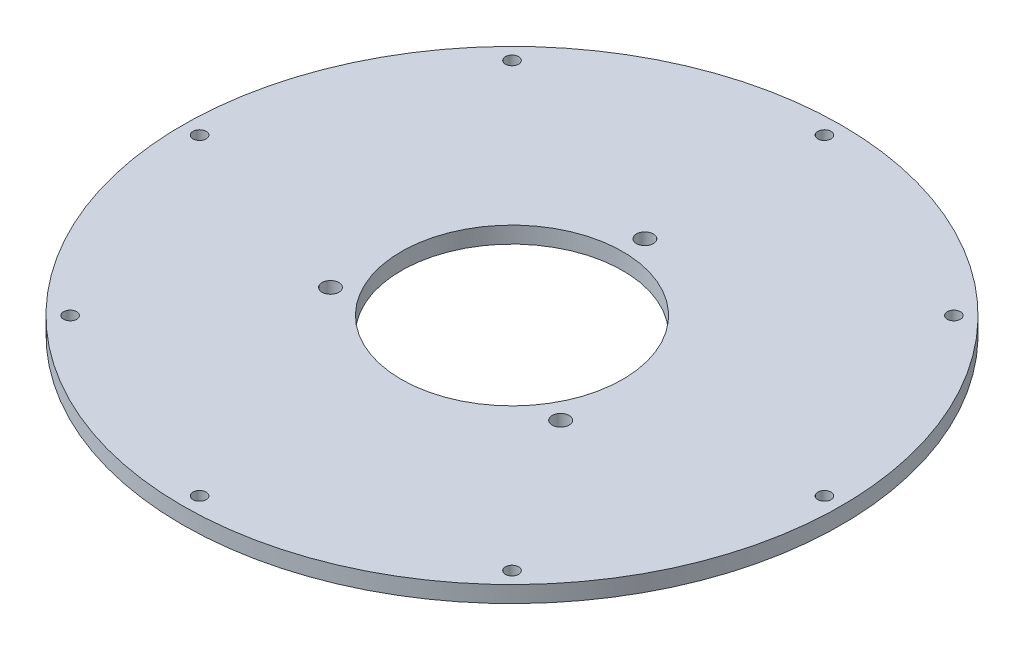
from build123d import *

# Parameters (mm, degrees)
SKETCH1_R           = 62.5
SKETCH1_R_2         = 21
BOSS_EXTRUDE1_DEPTH = 3.125
SKETCH2_R           = 1.6
CUT_EXTRUDE1_DEPTH  = 89.443573113
SKETCH6_R           = 1.25
CUT_EXTRUDE3_DEPTH  = 89.443573113


with BuildPart() as part:
    # Sketch1 → Boss-Extrude1 (new body)
    with BuildSketch(Plane(origin=(0, 0, 0), x_dir=(1, 0, 0), z_dir=(0, 1, 0))):
        with Locations(Location((0, 0, 0), (0, 0, 270))):
            Circle(SKETCH1_R)
        with Locations(Location((0, 0, 0), (0, 0, 270))):
            Circle(SKETCH1_R_2, mode=Mode.SUBTRACT)
    extrude(amount=BOSS_EXTRUDE1_DEPTH)

    # Sketch2 → Cut-Extrude1 (cut, through all)
    with BuildSketch(Plane(origin=(0, 3.125, 0), x_dir=(1, 0, 0), z_dir=(0, 1, 0))):
        with Locations(Location((0, 25.2, 0), (0, 0, 270))):
            Circle(SKETCH2_R)
        with Locations(Location((21.823840175, -12.6, 0), (0, 0, 270))):
            Circle(SKETCH2_R)
        with Locations(Location((-21.823840175, -12.6, 0), (0, 0, 270))):
            Circle(SKETCH2_R)
    extrude(amount=-CUT_EXTRUDE1_DEPTH, mode=Mode.SUBTRACT)

    # Sketch6 → Cut-Extrude3 (cut, through all)
    with BuildSketch(Plane(origin=(0, 3.125, 0), x_dir=(1, 0, 0), z_dir=(0, 1, 0))):
        with Locations(Location((-41.896076785, 41.896076785, 0), (0, 0, 270))):
            Circle(SKETCH6_R)
        with Locations(Location((41.896076785, 41.896076785, 0), (0, 0, 270))):
            Circle(SKETCH6_R)
        with Locations(Location((-41.896076785, -41.896076785, 0), (0, 0, 270))):
            Circle(SKETCH6_R)
        with Locations(Location((41.896076785, -41.896076785, 0), (0, 0, 270))):
            Circle(SKETCH6_R)
        with Locations(Location((-59.25, 0, 0), (0, 0, 270))):
            Circle(SKETCH6_R)
        with Locations(Location((59.25, 0, 0), (0, 0, 270))):
            Circle(SKETCH6_R)
        with Locations(Location((0, 59.25, 0), (0, 0, 270))):
            Circle(SKETCH6_R)
        with Locations(Location((0, -59.25, 0), (0, 0, 270))):
            Circle(SKETCH6_R)
    extrude(amount=-CUT_EXTRUDE3_DEPTH, mode=Mode.SUBTRACT)


solid = part.part
